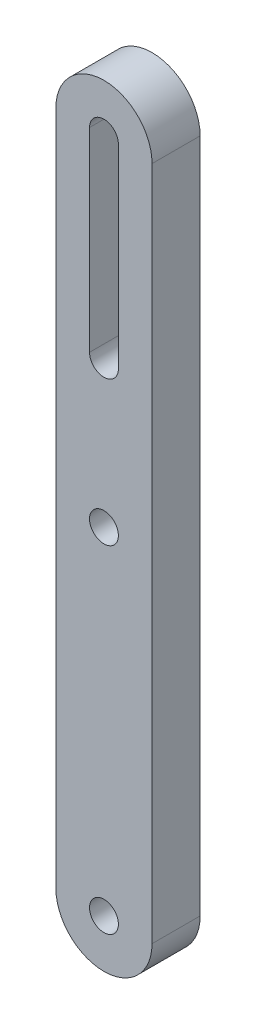
from build123d import *

# Parameters (mm, degrees)
CROQUIS1_R              = 1.5
SALIENTE_EXTRUIR1_DEPTH = 5
CORTAR_EXTRUIR1_START   = -10
CORTAR_EXTRUIR1_DEPTH   = 10
CROQUIS9_W              = 21.716341412
CROQUIS9_H              = 41.96907492
CORTAR_EXTRUIR2_DEPTH   = 10
SALIENTE_EXTRUIR2_DEPTH = 5
SALIENTE_EXTRUIR3_DEPTH = 5


with BuildPart() as part:
    # Croquis1 → Saliente-Extruir1 (new body)
    with BuildSketch(Plane.XY):
        with BuildLine():
            Line((5, 0), (5, -100))
            ThreePointArc((5, -100), (0, -105), (-5, -100))
            Line((-5, -100), (-5, 0))
            ThreePointArc((-5, 0), (0, 5), (5, 0))
        make_face()
        Circle(CROQUIS1_R, mode=Mode.SUBTRACT)
        with Locations((0, -100)):
            Circle(CROQUIS1_R, mode=Mode.SUBTRACT)
        with Locations((0, -65)):
            Circle(CROQUIS1_R, mode=Mode.SUBTRACT)
    extrude(amount=SALIENTE_EXTRUIR1_DEPTH)

    # Croquis8 → Cortar-Extruir1 (cut)
    with BuildSketch(Plane.XY.offset(5).offset(CORTAR_EXTRUIR1_START)):
        with BuildLine():
            Line((1.5, 0), (1.5, -50))
            ThreePointArc((1.5, -50), (0, -51.5), (-1.5, -50))
            Line((-1.5, -50), (-1.5, 0))
            ThreePointArc((-1.5, 0), (0, 1.5), (1.5, 0))
        make_face()
    extrude(amount=CORTAR_EXTRUIR1_DEPTH, mode=Mode.SUBTRACT)

    # Croquis9 → Cortar-Extruir2 (cut)
    with BuildSketch(Plane.XY.offset(5)):
        with Locations((5.858170706, -8.775938245)):
            Rectangle(CROQUIS9_W, CROQUIS9_H)
    extrude(amount=-CORTAR_EXTRUIR2_DEPTH, mode=Mode.SUBTRACT)



with BuildPart() as body_2:
    # Croquis10 → Saliente-Extruir2 (new body)
    with BuildSketch(Plane.XY.offset(5)):
        with BuildLine():
            Line((1.5, -29.760475705), (5, -29.760475705))
            ThreePointArc((5, -29.760475705), (0.000823646, -24.758830917), (-4.999998466, -29.758830217))
            Line((-4.999998466, -29.758830217), (-1.499999097, -29.758830217))
            ThreePointArc((-1.499999097, -29.758830217), (0.000823646, -28.258830443), (1.5, -29.760475705))
        make_face()
    extrude(amount=-SALIENTE_EXTRUIR2_DEPTH)


with BuildPart() as part_1:
    add(part.part)

    add(body_2.part)  # Saliente-Extruir3 merges body 2
    # Croquis11 → Saliente-Extruir3 (add)
    with BuildSketch(Plane(origin=(0, 0, 0), x_dir=(-1, 0, 0), z_dir=(0, 0, -1))):
        with BuildLine():
            Line((-5, -29.760475705), (-5, -32.237958703))
            Line((-5, -32.237958703), (-1.5, -32.237958703))
            Line((-1.5, -32.237958703), (-1.5, -29.760475705))
            ThreePointArc((-1.5, -29.760475705), (-0.000823646, -28.258830443), (1.499999097, -29.758830217))
            Line((1.499999097, -29.758830217), (1.499999097, -32.237958703))
            Line((1.499999097, -32.237958703), (5, -32.237958703))
            Line((5, -32.237958703), (4.999998466, -29.758830217))
            ThreePointArc((4.999998466, -29.758830217), (-0.000823646, -24.758830917), (-5, -29.760475705))
        make_face()
    extrude(amount=-SALIENTE_EXTRUIR3_DEPTH)


solid = part_1.part
